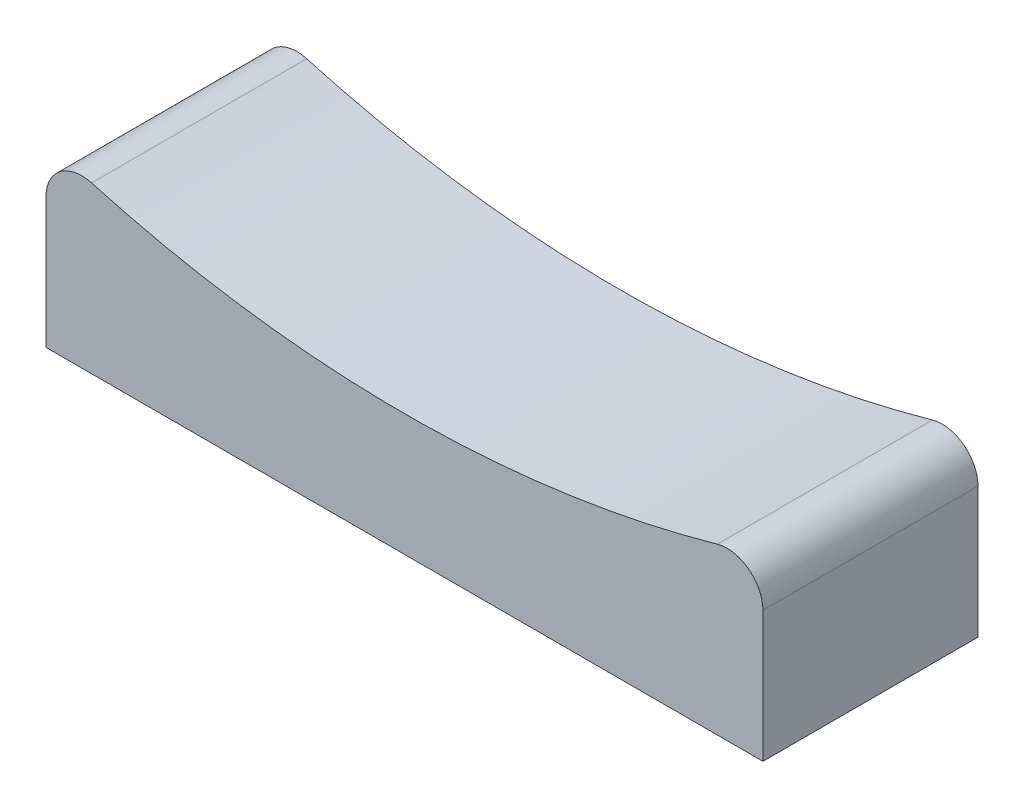
from build123d import *

# Parameters (mm, degrees)
SKETCH1_W           = 100
SKETCH1_H           = 30
BOSS_EXTRUDE1_DEPTH = 20
CUT_EXTRUDE1_DEPTH  = 62.64414003
FILLET1_R           = 5
SKETCH3_W           = 100
SKETCH3_H           = 30
BOSS_EXTRUDE2_DEPTH = 5
SKETCH4_R           = 7.675
CUT_EXTRUDE2_DEPTH  = 5
CHAMFER1_SIZE       = 1


with BuildPart() as part:
    # Sketch1 → Boss-Extrude1 (new body)
    with BuildSketch(Plane(origin=(0, 0, 0), x_dir=(1, 0, 0), z_dir=(0, 1, 0))):
        Rectangle(SKETCH1_W, SKETCH1_H)
    extrude(amount=BOSS_EXTRUDE1_DEPTH)

    # Sketch2 → Cut-Extrude1 (cut, through all)
    with BuildSketch(Plane.XY.offset(15)):
        with BuildLine():
            Line((-50, 20), (50, 20))
            ThreePointArc((50, 20), (0, 12), (-50, 20))
        make_face()
    extrude(amount=-CUT_EXTRUDE1_DEPTH, mode=Mode.SUBTRACT)

    # Fillet1
    fillet1_edges = [part.edges().sort_by_distance(p)[0] for p in [
        (-50, 20, 0),
        (50, 20, 0),
    ]]
    fillet(fillet1_edges, radius=FILLET1_R)

    # Sketch3 → Boss-Extrude2 (add)
    with BuildSketch(Plane.XZ):
        Rectangle(SKETCH3_W, SKETCH3_H)
    extrude(amount=BOSS_EXTRUDE2_DEPTH)

    # Sketch4 → Cut-Extrude2 (cut)
    with BuildSketch(Plane.XZ.offset(5)):
        with Locations(Location((0, 0, 0), (0, 0, 270))):
            Circle(SKETCH4_R)
    extrude(amount=-CUT_EXTRUDE2_DEPTH, mode=Mode.SUBTRACT)

    # Chamfer1
    chamfer1_edges = [part.edges().sort_by_distance(p)[0] for p in [
        (0, -5, 7.675),
    ]]
    chamfer(chamfer1_edges, length=CHAMFER1_SIZE)


solid = part.part
